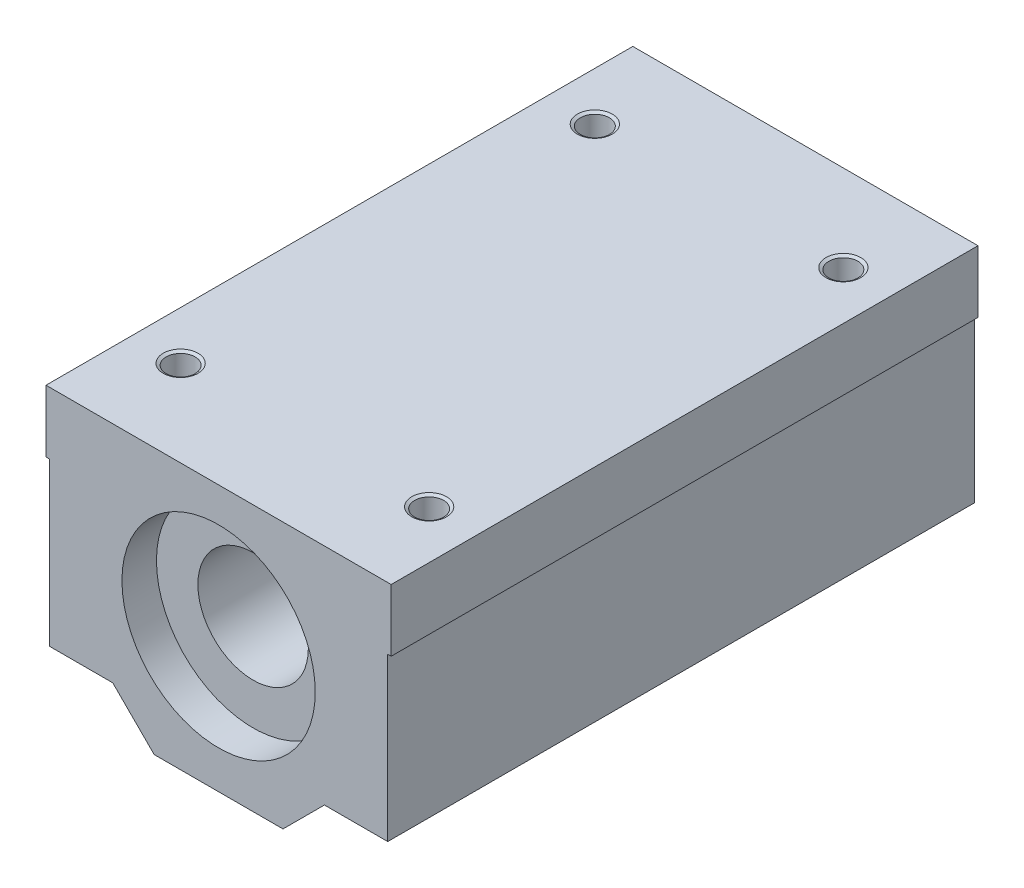
from build123d import *

# Parameters (mm, degrees)
SKETCH_1_R                  = 8
EXTRUDE_1_DEPTH             = 85
SKETCH_2_R                  = 1
CUT_EXTRUDE_1_DEPTH         = 97.603571363
HOLE_WIZARD_M51_D           = 4.2
HOLE_WIZARD_M51_DEPTH       = 14
HOLE_WIZARD_M51_CSINK_D     = 5.05
HOLE_WIZARD_M51_CSINK_ANGLE = 120
HOLE_WIZARD_M51_TIP         = 1.2618073
SKETCH_6_R                  = 2.15
CUT_EXTRUDE_3_DEPTH         = 24
SKETCH_7_R                  = 14
CUT_EXTRUDE_4_DEPTH         = 5
CUT_EXTRUDE_START           = -5
SKETCH_8_R                  = 14
CUT_EXTRUDE_5_DEPTH         = 5


with BuildPart() as part:
    # Эскиз1 → Бобышка-Вытянуть1 (new body)
    with BuildSketch(Plane.XY):
        Polygon((-25, 19), (25, 19), (25, 10), (24.5, 10), (24.5, -13.5), (15.329639, -13.5), (9.329639, -19.5), (-9.329639, -19.5), (-15.329639, -13.5), (-24.5, -13.5), (-24.5, 10), (-25, 10), align=None)
        Circle(SKETCH_1_R, mode=Mode.SUBTRACT)
    extrude(amount=EXTRUDE_1_DEPTH)

    # Эскиз2 → Вырез-Вытянуть1 (cut, through all)
    with BuildSketch(Plane(origin=(0, 19, 0), x_dir=(1, 0, 0), z_dir=(0, 1, 0))):
        with Locations(Location((-18, -12.5, 0), (0, 0, 270))):
            Circle(SKETCH_2_R)
        with Locations(Location((-18, -72.5, 0), (0, 0, 270))):
            Circle(SKETCH_2_R)
        with Locations(Location((18, -72.5, 0), (0, 0, 270))):
            Circle(SKETCH_2_R)
        with Locations(Location((18, -12.5, 0), (0, 0, 270))):
            Circle(SKETCH_2_R)
    extrude(amount=-CUT_EXTRUDE_1_DEPTH, mode=Mode.SUBTRACT)

    # Отверстие обработанное метчиком M51
    with Locations(Plane(origin=(0, 19, 0), x_dir=(-1, 0, 0), z_dir=(0, 1, 0))):
        with Locations((-18, 12.5), (-18, 72.5), (18, 72.5), (18, 12.5)):
            CounterSinkHole(HOLE_WIZARD_M51_D / 2, HOLE_WIZARD_M51_CSINK_D / 2, depth=HOLE_WIZARD_M51_DEPTH, counter_sink_angle=HOLE_WIZARD_M51_CSINK_ANGLE)
            with Locations((0, 0, -(HOLE_WIZARD_M51_DEPTH + HOLE_WIZARD_M51_TIP / 2))):  # 118° drill point
                Cone(0, HOLE_WIZARD_M51_D / 2, HOLE_WIZARD_M51_TIP, mode=Mode.SUBTRACT)

    # Эскиз6 → Вырез-Вытянуть3 (cut)
    with BuildSketch(Plane.XZ.offset(13.5)):
        with Locations(Location((-18, 72.5, 0), (0, 0, 270))):
            Circle(SKETCH_6_R)
        with Locations(Location((18, 72.5, 0), (0, 0, 270))):
            Circle(SKETCH_6_R)
        with Locations(Location((18, 12.5, 0), (0, 0, 270))):
            Circle(SKETCH_6_R)
        with Locations(Location((-18, 12.5, 0), (0, 0, 270))):
            Circle(SKETCH_6_R)
    extrude(amount=-CUT_EXTRUDE_3_DEPTH, mode=Mode.SUBTRACT)

    # Эскиз7 → Вырез-Вытянуть4 (cut)
    with BuildSketch(Plane(origin=(0, 0, 0), x_dir=(-1, 0, 0), z_dir=(0, 0, -1))):
        Circle(SKETCH_7_R)
    extrude(amount=-CUT_EXTRUDE_4_DEPTH, mode=Mode.SUBTRACT)

    # Эскиз8 → Вырез-Вытянуть5 (cut)
    with BuildSketch(Plane.XY.offset(85).offset(CUT_EXTRUDE_START)):
        with Locations(Location((0, 0, 0), (0, 0, 180))):
            Circle(SKETCH_8_R)
    extrude(amount=CUT_EXTRUDE_5_DEPTH, mode=Mode.SUBTRACT)


solid = part.part
